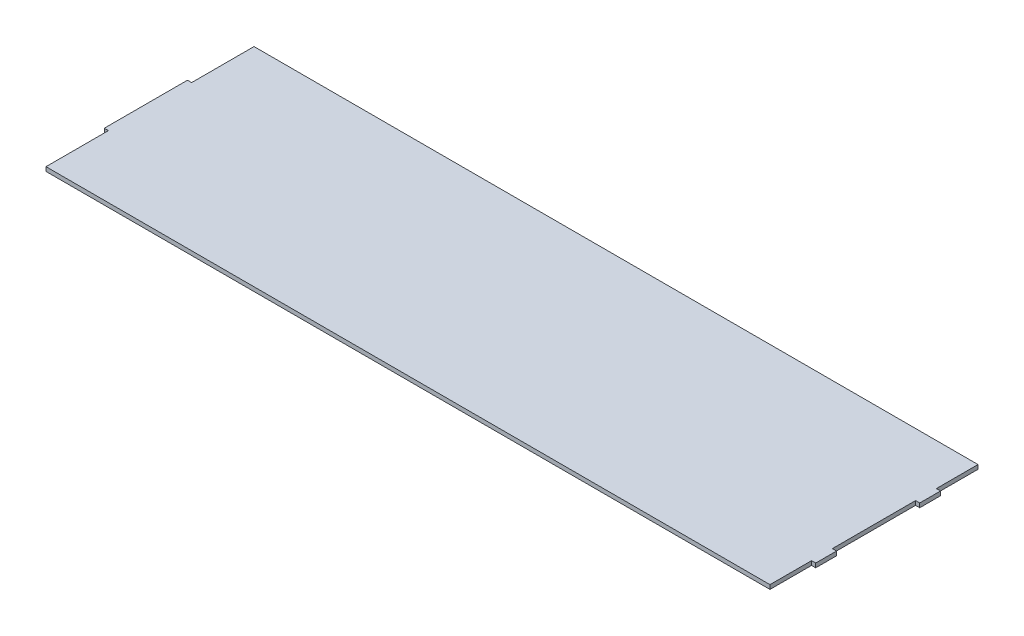
from build123d import *

# Parameters (mm, degrees)
SKETCH_1_W      = 2
SKETCH_1_H      = 10
SKETCH_1_W_2    = 348
SKETCH_1_H_2    = 100
SKETCH_1_H_3    = 40
EXTRUDE_1_DEPTH = 2


with BuildPart() as part:
    # 草图1 → 凸台-拉伸1 (new body)
    with BuildSketch(Plane(origin=(0, 0, 0), x_dir=(1, 0, 0), z_dir=(0, 1, 0))):
        with Locations((349, 25)):
            Rectangle(SKETCH_1_W, SKETCH_1_H)
        with Locations((349, 75)):
            Rectangle(SKETCH_1_W, SKETCH_1_H)
        with Locations((174, 50)):
            Rectangle(SKETCH_1_W_2, SKETCH_1_H_2)
        with Locations((-1, 50)):
            Rectangle(SKETCH_1_W, SKETCH_1_H_3)
    extrude(amount=EXTRUDE_1_DEPTH)


solid = part.part
